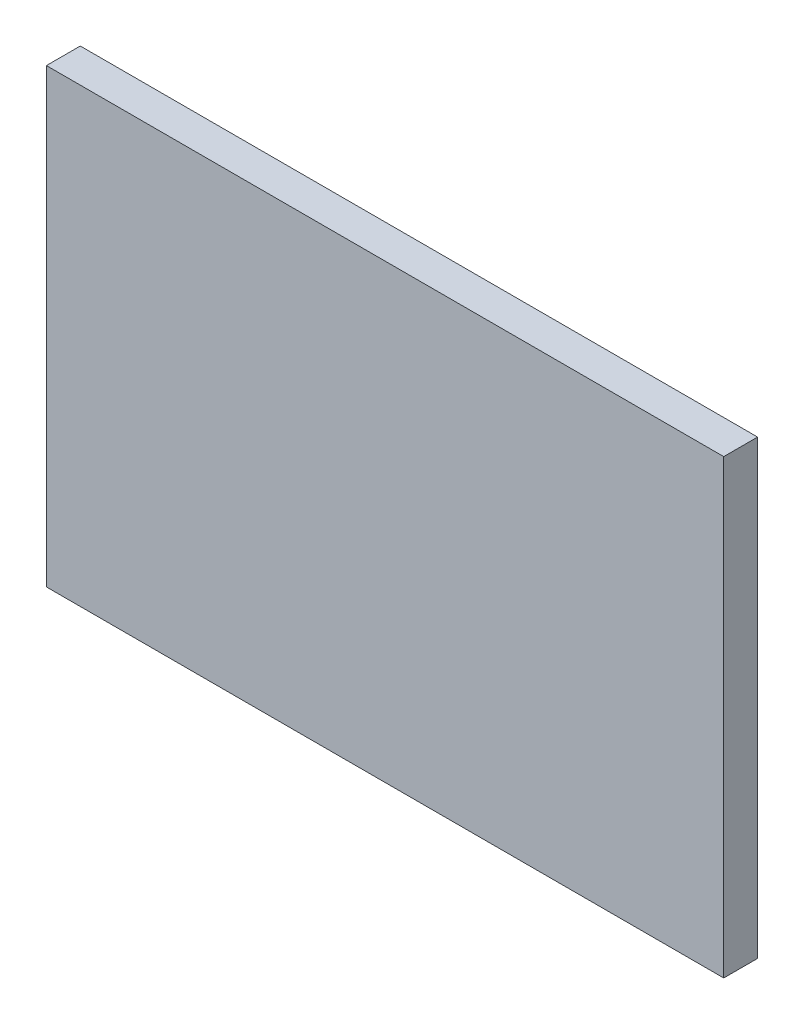
from build123d import *

# Parameters (mm, degrees)
ESQUISSE1_W        = 150
ESQUISSE1_H        = 100
BOSS_EXTRU_1_DEPTH = 7.5


with BuildPart() as part:
    # Esquisse1 → Boss.-Extru.1 (new body)
    with BuildSketch(Plane.XY):
        with Locations((-37.872937735, 19.029850746)):
            Rectangle(ESQUISSE1_W, ESQUISSE1_H)
    extrude(amount=BOSS_EXTRU_1_DEPTH)


solid = part.part
